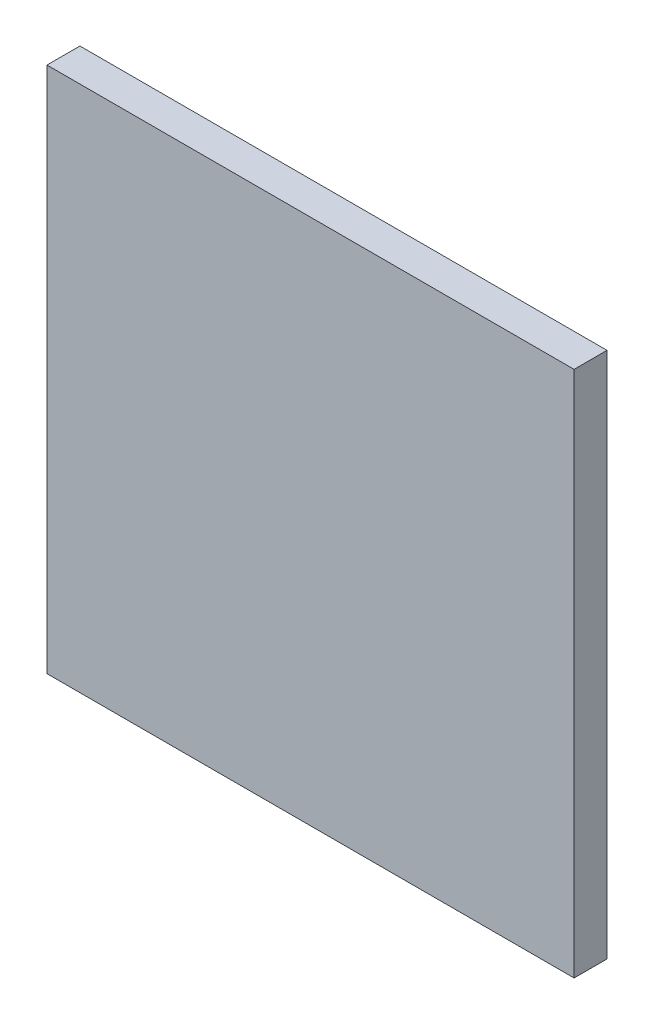
from build123d import *

# Parameters (mm, degrees)
SKETCH1_W           = 609.6
SKETCH1_H           = 609.6
BOSS_EXTRUDE1_DEPTH = 38.1


with BuildPart() as part:
    # Sketch1 → Boss-Extrude1 (new body)
    with BuildSketch(Plane.XY):
        with Locations((-8932.741174342, -2581.800000001)):
            Rectangle(SKETCH1_W, SKETCH1_H)
    extrude(amount=BOSS_EXTRUDE1_DEPTH)


solid = part.part
